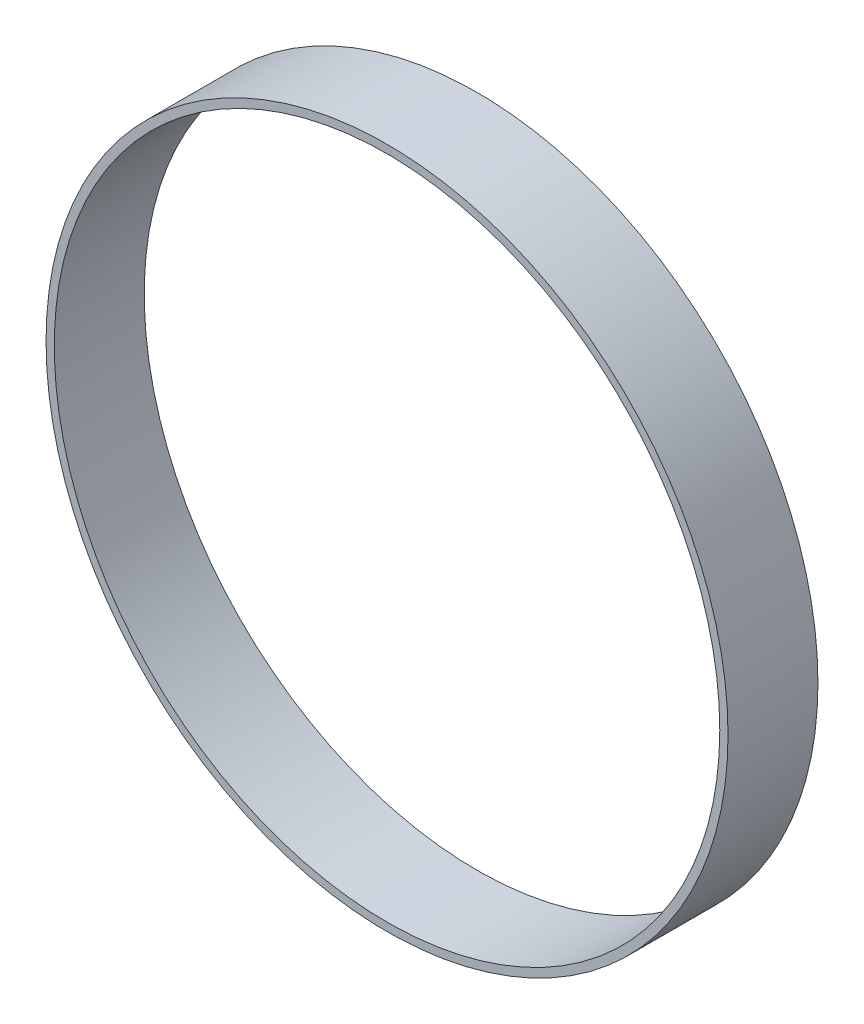
from build123d import *

# Parameters (mm, degrees)
SKETCH_1_R      = 45.5
SKETCH_1_R_2    = 44.4
EXTRUDE_1_DEPTH = 12


with BuildPart() as part:
    # ｽｹｯﾁ1 → ﾎﾞｽ - 押し出し1 (new body)
    with BuildSketch(Plane.XY):
        Circle(SKETCH_1_R)
        Circle(SKETCH_1_R_2, mode=Mode.SUBTRACT)
    extrude(amount=EXTRUDE_1_DEPTH)


solid = part.part
